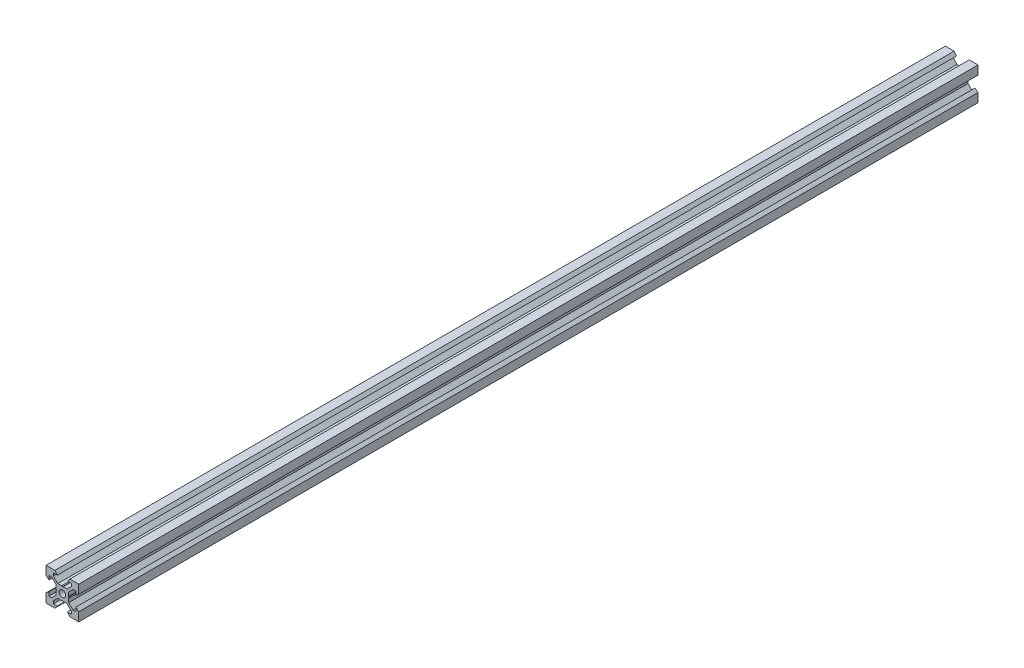
from build123d import *

# Parameters (mm, degrees)
SKETCH1_R           = 2
BOSS_EXTRUDE1_DEPTH = 275


with BuildPart() as part:
    # Sketch1 → Boss-Extrude1 (new, symmetric)
    with BuildSketch(Plane.XY):
        Polygon((10, 10), (10, 4.610379336), (8.2, 3.1), (8.2, 5.5), (6.560660172, 5.5), (3.9, 2.839339828), (3.9, 0.519615242), (3.6, 0), (3.9, -0.519615242), (3.9, -2.839339828), (6.560660172, -5.5), (8.2, -5.5), (8.2, -3.1), (10, -4.610379336), (10, -10), (4.610379336, -10), (3.1, -8.2), (5.5, -8.2), (5.5, -6.560660172), (2.839339828, -3.9), (0.519615242, -3.9), (0, -3.6), (-0.519615242, -3.9), (-2.839339828, -3.9), (-5.5, -6.560660172), (-5.5, -8.2), (-3.1, -8.2), (-4.610379336, -10), (-10, -10), (-10, -4.610379336), (-8.2, -3.1), (-8.2, -5.5), (-6.560660172, -5.5), (-3.9, -2.839339828), (-3.9, -0.519615242), (-3.6, 0), (-3.9, 0.519615242), (-3.9, 2.839339828), (-6.560660172, 5.5), (-8.2, 5.5), (-8.2, 3.1), (-10, 4.610379336), (-10, 10), (-4.610379336, 10), (-3.1, 8.2), (-5.5, 8.2), (-5.5, 6.560660172), (-2.839339828, 3.9), (-0.519615242, 3.9), (0, 3.6), (0.519615242, 3.9), (2.839339828, 3.9), (5.5, 6.560660172), (5.5, 8.2), (3.1, 8.2), (4.610379336, 10), align=None)
        Circle(SKETCH1_R, mode=Mode.SUBTRACT)
    extrude(amount=BOSS_EXTRUDE1_DEPTH, both=True)


solid = part.part
